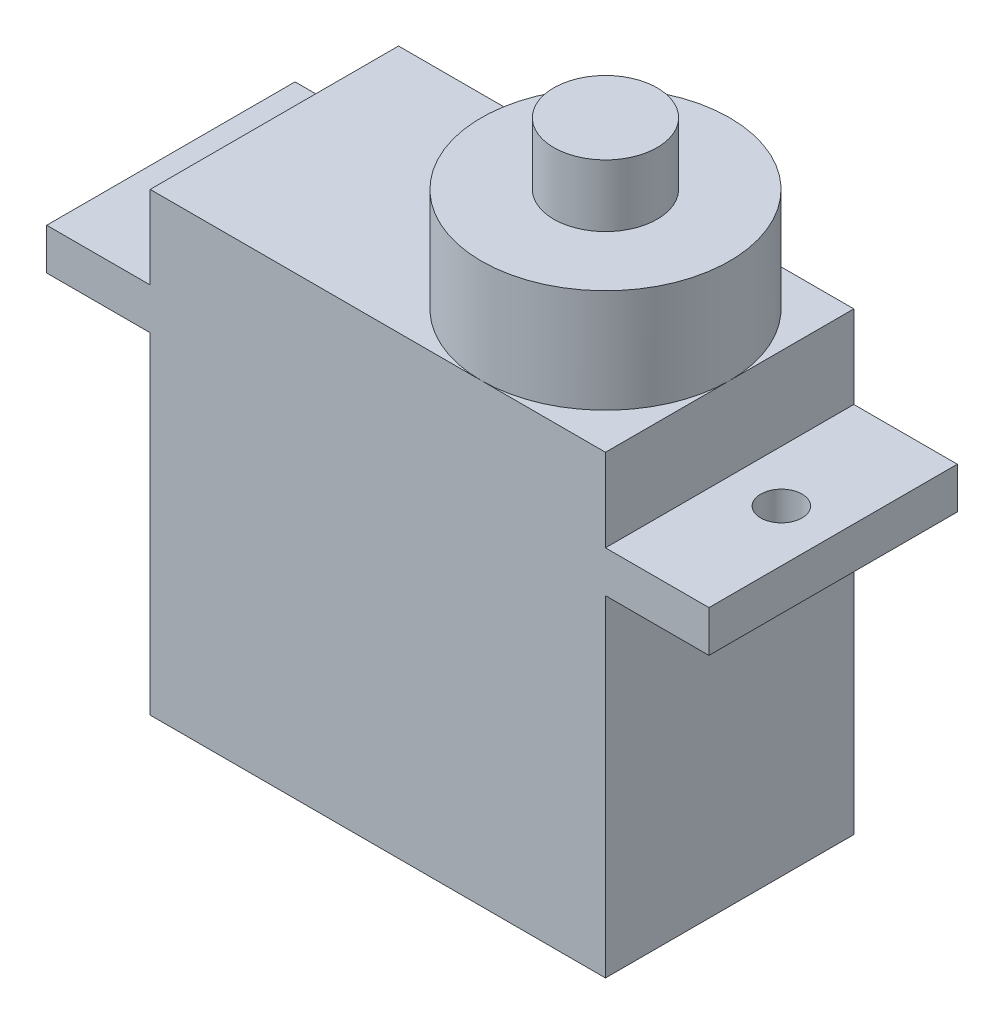
from build123d import *

# Parameters (mm, degrees)
SKETCH1_W           = 22
SKETCH1_H           = 12
BOSS_EXTRUDE1_DEPTH = 22
SKETCH2_W           = 32
SKETCH2_H           = 2
BOSS_EXTRUDE2_DEPTH = 12
SKETCH3_R           = 1
CUT_EXTRUDE1_DEPTH  = 22
SKETCH5_R           = 6
BOSS_EXTRUDE3_DEPTH = 5
SKETCH6_R           = 2.5
BOSS_EXTRUDE4_DEPTH = 3


with BuildPart() as part:
    # Sketch1 → Boss-Extrude1 (new body)
    with BuildSketch(Plane(origin=(0, 0, 0), x_dir=(1, 0, 0), z_dir=(0, 1, 0))):
        with Locations((11, 6)):
            Rectangle(SKETCH1_W, SKETCH1_H)
    extrude(amount=BOSS_EXTRUDE1_DEPTH)

    # Sketch2 → Boss-Extrude2 (add, through all)
    with BuildSketch(Plane.XY):
        with Locations((11, 17)):
            Rectangle(SKETCH2_W, SKETCH2_H)
    extrude(amount=-BOSS_EXTRUDE2_DEPTH)

    # Sketch3 → Cut-Extrude1 (cut)
    with BuildSketch(Plane(origin=(0, 18, 0), x_dir=(1, 0, 0), z_dir=(0, 1, 0))):
        with Locations(Location((-2.5, 6, 0), (0, 0, 270))):
            Circle(SKETCH3_R)
        with Locations(Location((24.5, 6, 0), (0, 0, 270))):
            Circle(SKETCH3_R)
    extrude(amount=-CUT_EXTRUDE1_DEPTH, mode=Mode.SUBTRACT)

    # Sketch5 → Boss-Extrude3 (add)
    with BuildSketch(Plane(origin=(0, 22, 0), x_dir=(1, 0, 0), z_dir=(0, 1, 0))):
        with Locations(Location((16, 6, 0), (0, 0, 270))):
            Circle(SKETCH5_R)
    extrude(amount=BOSS_EXTRUDE3_DEPTH)

    # Sketch6 → Boss-Extrude4 (add)
    with BuildSketch(Plane(origin=(0, 27, 0), x_dir=(1, 0, 0), z_dir=(0, 1, 0))):
        with Locations(Location((16, 6, 0), (0, 0, 270))):
            Circle(SKETCH6_R)
    extrude(amount=BOSS_EXTRUDE4_DEPTH)


solid = part.part
